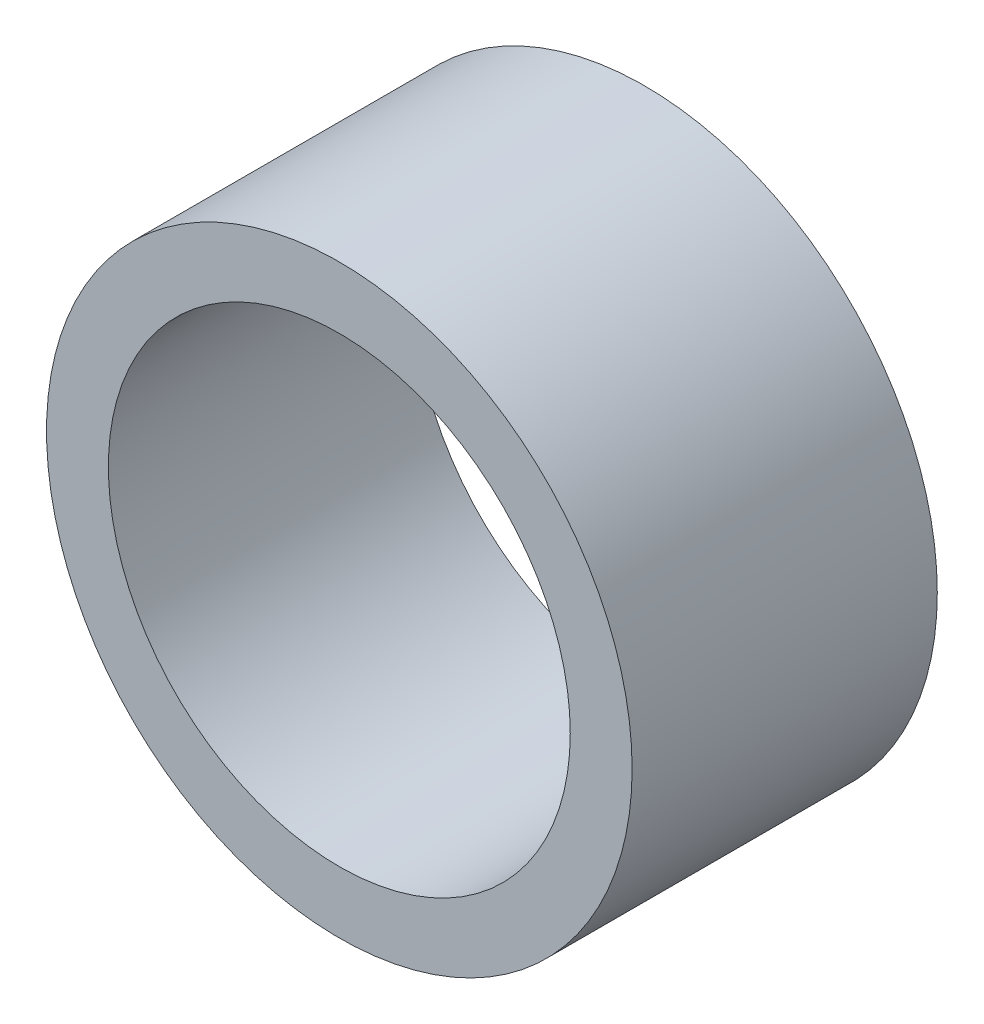
from build123d import *

# Parameters (mm, degrees)
ESQUISSE1_R      = 17.75
ESQUISSE1_R_2    = 14
EXTRUSION1_DEPTH = 18.5


with BuildPart() as part:
    # Esquisse1 → Extrusion1 (new body)
    with BuildSketch(Plane.XY):
        Circle(ESQUISSE1_R)
        Circle(ESQUISSE1_R_2, mode=Mode.SUBTRACT)
    extrude(amount=EXTRUSION1_DEPTH)


solid = part.part
